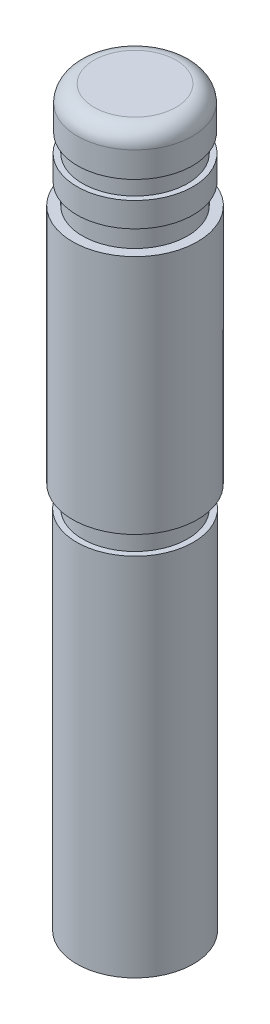
from build123d import *


with BuildPart() as part:
    # 草图1 → 旋转4 (revolve)
    with BuildSketch(Plane(origin=(0, 0, 0), x_dir=(0, 0, -1), z_dir=(1, 0, 0)), mode=Mode.PRIVATE) as revolve_4_sk:
        with BuildLine():
            Line((-7, 0), (0, 0))
            Line((0, 0), (0, 88))
            Line((0, 88), (-4.914147633, 88))
            ThreePointArc((-4.914147633, 88), (-6.328361195, 87.414213562), (-6.914147633, 86))
            Line((-6.914147633, 86), (-6.914147633, 82.933330123))
            Line((-6.914147633, 82.933330123), (-6.309364611, 82.933330123))
            Line((-6.309364611, 82.933330123), (-6.309364611, 80.780984357))
            Line((-6.309364611, 80.780984357), (-6.960648153, 80.780984357))
            Line((-6.960648153, 80.780984357), (-6.960648153, 77.82908336))
            Line((-6.960648153, 77.82908336), (-6.309364611, 77.82908336))
            Line((-6.309364611, 77.82908336), (-6.309364611, 75.328381362))
            Line((-6.309364611, 75.328381362), (-7.5, 75.328381362))
            Line((-7.5, 75.328381362), (-7.5, 46.447151695))
            Line((-7.5, 46.447151695), (-6.309364611, 46.447151695))
            Line((-6.309364611, 46.447151695), (-6.309364611, 43.835644878))
            Line((-6.309364611, 43.835644878), (-7, 43.835644878))
            Line((-7, 43.835644878), (-7, 0))
        make_face()
    revolve(revolve_4_sk.sketch.rotate(Axis((0, 0, 0), (0, 1, 0)), 180), axis=Axis((0, 0, 0), (0, 1, 0)))


solid = part.part
